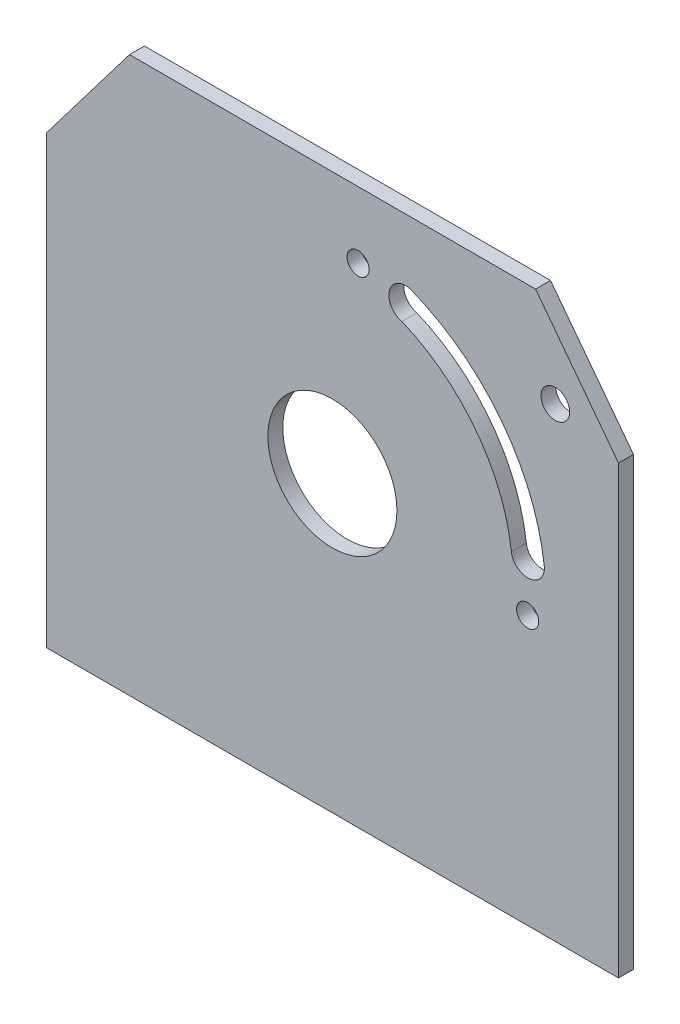
from build123d import *

# Parameters (mm, degrees)
SKETCH1_R      = 14.280154621
SKETCH1_R_2    = 3.175
SKETCH1_R_3    = 2.445943814
EXTRUDE1_DEPTH = 3.302


with BuildPart() as part:
    # Sketch1 → Extrude1 (new body)
    with BuildSketch(Plane.XY):
        Polygon((122.018241697, 78.932176277), (103.665120274, 103.090232189), (13.814462921, 103.090232189), (-4.538658503, 78.932176277), (-4.538658503, -19.747260734), (122.018241697, -19.747260734), align=None)
        with Locations((58.710249945, 45.283910371)):
            Circle(SKETCH1_R, mode=Mode.SUBTRACT)
        with Locations((108.031447678, 83.274598732)):
            Circle(SKETCH1_R_2, mode=Mode.SUBTRACT)
        with Locations((64.386022104, 88.408658993)):
            Circle(SKETCH1_R_3, mode=Mode.SUBTRACT)
        with Locations(Location((101.914361119, 39.6877037, 0), (0, 0, 180))):
            Circle(SKETCH1_R_3, mode=Mode.SUBTRACT)
        with BuildLine():
            ThreePointArc((105.584923307, 50.978901238), (96.144059082, 74.065464486), (76.258457488, 89.121432379))
            ThreePointArc((76.258457488, 89.121432379), (71.3691103, 86.793097674), (74.070723534, 82.099682674))
            ThreePointArc((74.070723534, 82.099682674), (90.512346787, 69.36651562), (98.311501424, 50.088712183))
            ThreePointArc((98.311501424, 50.088712183), (102.393306893, 46.897095769), (105.584923307, 50.978901238))
        make_face(mode=Mode.SUBTRACT)
    extrude(amount=EXTRUDE1_DEPTH)


solid = part.part
